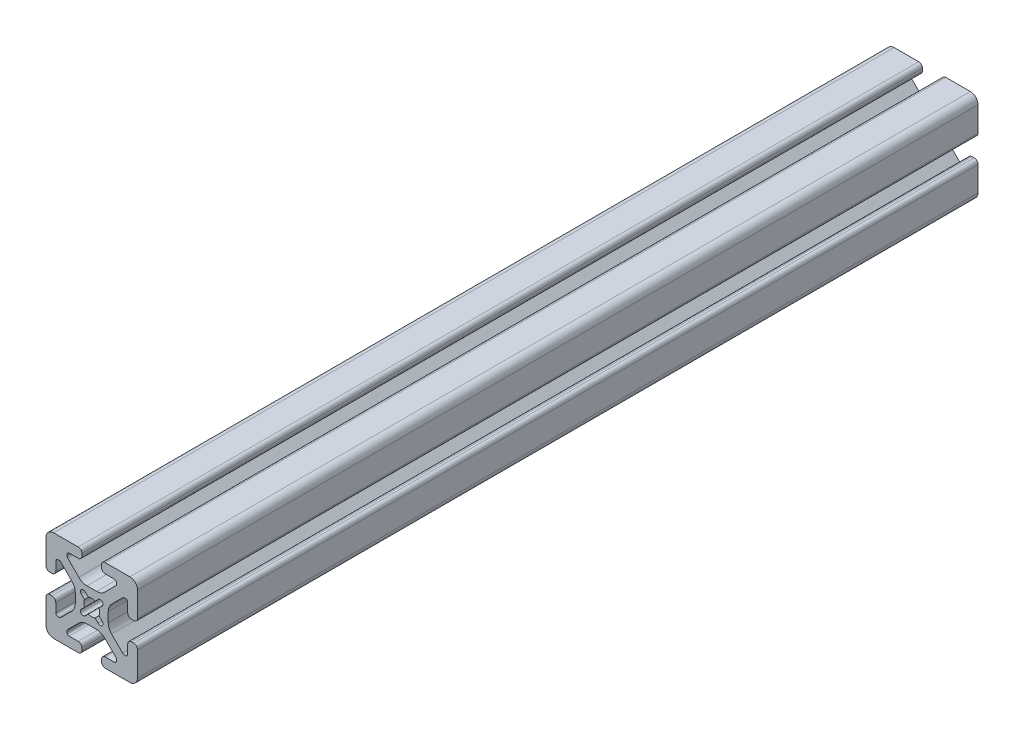
from build123d import *

# Parameters (mm, degrees)
EXTRUDE1_DEPTH = 350


with BuildPart() as part:
    # Sketch1 → Extrude1 (new body)
    with BuildSketch(Plane.XY):
        with BuildLine():
            Line((14.986, -5.6388), (14.986, -9.398))
            ThreePointArc((14.986, -9.398), (14.725617928, -10.026617928), (14.097, -10.287))
            Line((14.097, -10.287), (13.528917816, -10.287))
            ThreePointArc((13.528917816, -10.287), (13.188712244, -10.219328904), (12.900299887, -10.026617928))
            Line((12.900299887, -10.026617928), (8.260840349, -5.38715839))
            ThreePointArc((8.260840349, -5.38715839), (7.231213135, -3.846212368), (6.869656138, -2.028542601))
            Line((6.869656138, -2.028542601), (6.869656138, 2.028542601))
            ThreePointArc((6.869656138, 2.028542601), (7.231213135, 3.846212368), (8.260840349, 5.38715839))
            Line((8.260840349, 5.38715839), (12.900299887, 10.026617929))
            ThreePointArc((12.900299887, 10.026617929), (13.188712244, 10.219328904), (13.528917816, 10.287))
            Line((13.528917816, 10.287), (14.097, 10.287))
            ThreePointArc((14.097, 10.287), (14.725617928, 10.026617929), (14.986, 9.398))
            Line((14.986, 9.398), (14.986, 5.6388))
            ThreePointArc((14.986, 5.6388), (15.447248241, 4.525248241), (16.5608, 4.064))
            Line((16.5608, 4.064), (17.4752, 4.064))
            ThreePointArc((17.4752, 4.064), (18.588751759, 4.525248241), (19.05, 5.6388))
            Line((19.05, 5.6388), (19.05, 15.875))
            ThreePointArc((19.05, 15.875), (18.12006403, 18.12006403), (15.875, 19.05))
            Line((15.875, 19.05), (5.6388, 19.05))
            ThreePointArc((5.6388, 19.05), (4.525248241, 18.588751759), (4.064, 17.4752))
            Line((4.064, 17.4752), (4.064, 16.5608))
            ThreePointArc((4.064, 16.5608), (4.525248241, 15.447248241), (5.6388, 14.986))
            Line((5.6388, 14.986), (9.398, 14.986))
            ThreePointArc((9.398, 14.986), (10.026617928, 14.725617928), (10.287, 14.097))
            Line((10.287, 14.097), (10.287, 13.528917816))
            ThreePointArc((10.287, 13.528917816), (10.219328904, 13.188712244), (10.026617928, 12.900299887))
            Line((10.026617928, 12.900299887), (5.38715839, 8.260840349))
            ThreePointArc((5.38715839, 8.260840349), (3.846212368, 7.231213135), (2.028542601, 6.869656138))
            Line((2.028542601, 6.869656138), (-2.028542601, 6.869656138))
            ThreePointArc((-2.028542601, 6.869656138), (-3.846212368, 7.231213135), (-5.38715839, 8.260840349))
            Line((-5.38715839, 8.260840349), (-10.026617929, 12.900299887))
            ThreePointArc((-10.026617929, 12.900299887), (-10.219328904, 13.188712244), (-10.287, 13.528917816))
            Line((-10.287, 13.528917816), (-10.287, 14.097))
            ThreePointArc((-10.287, 14.097), (-10.026617929, 14.725617928), (-9.398, 14.986))
            Line((-9.398, 14.986), (-5.6388, 14.986))
            ThreePointArc((-5.6388, 14.986), (-4.525248241, 15.447248241), (-4.064, 16.5608))
            Line((-4.064, 16.5608), (-4.064, 17.4752))
            ThreePointArc((-4.064, 17.4752), (-4.525248241, 18.588751759), (-5.6388, 19.05))
            Line((-5.6388, 19.05), (-15.875, 19.05))
            ThreePointArc((-15.875, 19.05), (-18.12006403, 18.12006403), (-19.05, 15.875))
            Line((-19.05, 15.875), (-19.05, 5.6388))
            ThreePointArc((-19.05, 5.6388), (-18.588751759, 4.525248241), (-17.4752, 4.064))
            Line((-17.4752, 4.064), (-16.5608, 4.064))
            ThreePointArc((-16.5608, 4.064), (-15.447248241, 4.525248241), (-14.986, 5.6388))
            Line((-14.986, 5.6388), (-14.986, 9.398))
            ThreePointArc((-14.986, 9.398), (-14.725617929, 10.026617928), (-14.097, 10.287))
            Line((-14.097, 10.287), (-13.528917816, 10.287))
            ThreePointArc((-13.528917816, 10.287), (-13.188712244, 10.219328904), (-12.900299887, 10.026617928))
            Line((-12.900299887, 10.026617928), (-8.260840349, 5.38715839))
            ThreePointArc((-8.260840349, 5.38715839), (-7.231213135, 3.846212368), (-6.869656138, 2.028542601))
            Line((-6.869656138, 2.028542601), (-6.869656138, -2.028542601))
            ThreePointArc((-6.869656138, -2.028542601), (-7.231213135, -3.846212368), (-8.260840349, -5.38715839))
            Line((-8.260840349, -5.38715839), (-12.900299887, -10.026617928))
            ThreePointArc((-12.900299887, -10.026617928), (-13.188712244, -10.219328904), (-13.528917816, -10.287))
            Line((-13.528917816, -10.287), (-14.097, -10.287))
            ThreePointArc((-14.097, -10.287), (-14.725617928, -10.026617928), (-14.986, -9.398))
            Line((-14.986, -9.398), (-14.986, -5.6388))
            ThreePointArc((-14.986, -5.6388), (-15.447248241, -4.525248241), (-16.5608, -4.064))
            Line((-16.5608, -4.064), (-17.4752, -4.064))
            ThreePointArc((-17.4752, -4.064), (-18.588751759, -4.525248241), (-19.05, -5.6388))
            Line((-19.05, -5.6388), (-19.05, -15.875))
            ThreePointArc((-19.05, -15.875), (-18.12006403, -18.12006403), (-15.875, -19.05))
            Line((-15.875, -19.05), (-5.6388, -19.05))
            ThreePointArc((-5.6388, -19.05), (-4.525248241, -18.588751759), (-4.064, -17.4752))
            Line((-4.064, -17.4752), (-4.064, -16.5608))
            ThreePointArc((-4.064, -16.5608), (-4.525248241, -15.447248241), (-5.6388, -14.986))
            Line((-5.6388, -14.986), (-9.398, -14.986))
            ThreePointArc((-9.398, -14.986), (-10.026617928, -14.725617928), (-10.287, -14.097))
            Line((-10.287, -14.097), (-10.287, -13.528917816))
            ThreePointArc((-10.287, -13.528917816), (-10.219328904, -13.188712244), (-10.026617928, -12.900299887))
            Line((-10.026617928, -12.900299887), (-5.38715839, -8.260840349))
            ThreePointArc((-5.38715839, -8.260840349), (-3.846212368, -7.231213135), (-2.028542601, -6.869656138))
            Line((-2.028542601, -6.869656138), (2.028542601, -6.869656138))
            ThreePointArc((2.028542601, -6.869656138), (3.846212368, -7.231213135), (5.38715839, -8.260840349))
            Line((5.38715839, -8.260840349), (10.026617928, -12.900299887))
            ThreePointArc((10.026617928, -12.900299887), (10.219328904, -13.188712244), (10.287, -13.528917816))
            Line((10.287, -13.528917816), (10.287, -14.097))
            ThreePointArc((10.287, -14.097), (10.026617928, -14.725617928), (9.398, -14.986))
            Line((9.398, -14.986), (5.6388, -14.986))
            ThreePointArc((5.6388, -14.986), (4.525248241, -15.447248241), (4.064, -16.5608))
            Line((4.064, -16.5608), (4.064, -17.4752))
            ThreePointArc((4.064, -17.4752), (4.525248241, -18.588751759), (5.6388, -19.05))
            Line((5.6388, -19.05), (15.875, -19.05))
            ThreePointArc((15.875, -19.05), (18.12006403, -18.12006403), (19.05, -15.875))
            Line((19.05, -15.875), (19.05, -5.6388))
            ThreePointArc((19.05, -5.6388), (18.588751759, -4.525248241), (17.4752, -4.064))
            Line((17.4752, -4.064), (16.5608, -4.064))
            ThreePointArc((16.5608, -4.064), (15.447248241, -4.525248241), (14.986, -5.6388))
        make_face()
        with BuildLine():
            Line((4.24561082, 2.639761197), (3.01775857, 1.401686117))
            ThreePointArc((3.01775857, 1.401686117), (3.327399997, 0.000140662), (3.017877069, -1.401430967))
            Line((3.017877069, -1.401430967), (4.343300873, -2.726854771))
            ThreePointArc((4.343300873, -2.726854771), (4.343300873, -4.343300873), (2.726854771, -4.343300873))
            Line((2.726854771, -4.343300873), (1.401430967, -3.017877069))
            ThreePointArc((1.401430967, -3.017877069), (0, -3.3274), (-1.401430967, -3.017877069))
            Line((-1.401430967, -3.017877069), (-2.726854771, -4.343300873))
            ThreePointArc((-2.726854771, -4.343300873), (-4.343300873, -4.343300873), (-4.343300873, -2.726854771))
            Line((-4.343300873, -2.726854771), (-3.017877069, -1.401430967))
            ThreePointArc((-3.017877069, -1.401430967), (-3.3274, 0), (-3.017877069, 1.401430967))
            Line((-3.017877069, 1.401430967), (-4.343300873, 2.726854771))
            ThreePointArc((-4.343300873, 2.726854771), (-4.343300873, 4.343300873), (-2.726854771, 4.343300873))
            Line((-2.726854771, 4.343300873), (-1.401430967, 3.017877069))
            ThreePointArc((-1.401430967, 3.017877069), (0.000140662, 3.327399997), (1.401686117, 3.01775857))
            Line((1.401686117, 3.01775857), (2.639761197, 4.24561082))
            ThreePointArc((2.639761197, 4.24561082), (4.343300873, 4.343300873), (4.24561082, 2.639761197))
        make_face(mode=Mode.SUBTRACT)
    extrude(amount=-EXTRUDE1_DEPTH)


solid = part.part
